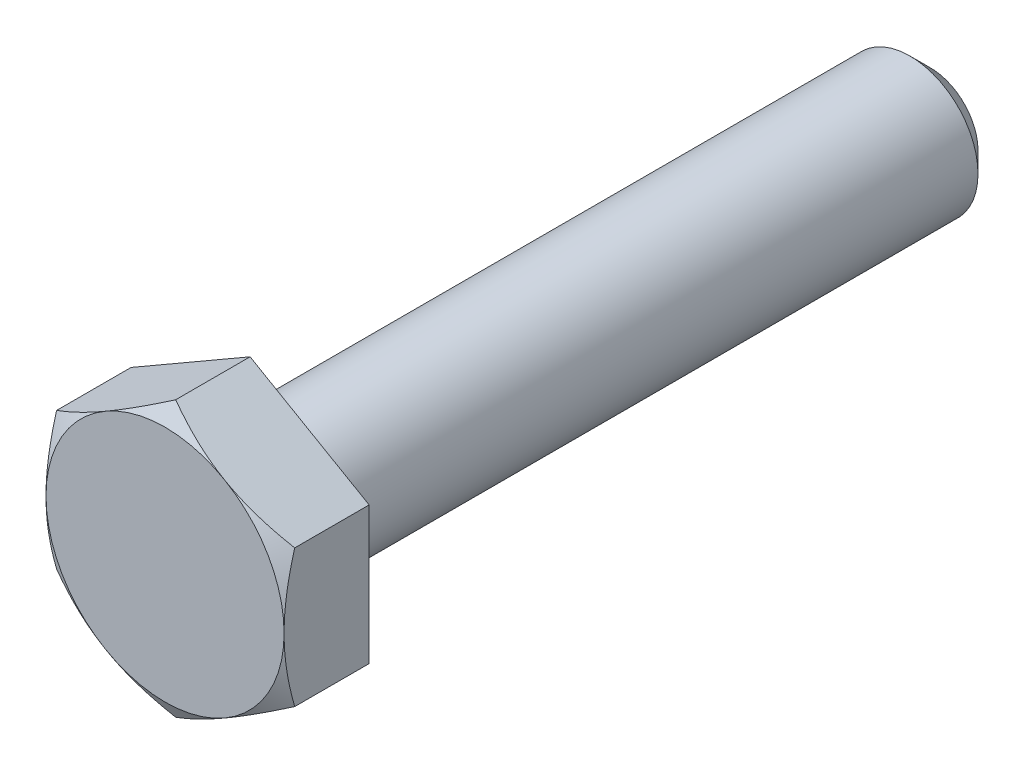
from build123d import *

# Parameters (mm, degrees)
SKETCH4_OUTSIDE_W  = 22.844
SKETCH4_OUTSIDE_H  = 22.844
CUT_EXTRUDE1_DEPTH = 37.85314377


with BuildPart() as part:
    # Sketch3 → Revolve1 (revolve)
    with BuildSketch(Plane(origin=(0, 0, 0), x_dir=(0, 0, -1), z_dir=(1, 0, 0))):
        Polygon((17.859375, 2.2225), (17.859375, 0), (-17.859375, 0), (-17.859375, 5.55625), (-17.363110767, 6.415804866), (-13.890625, 6.415804866), (-13.890625, 3.175), (16.906875, 3.175), align=None)
    revolve(axis=Axis((0, 0, 17.859375), (0, 0, -1)))

    # Sketch4 outside → Cut-Extrude1 (cut, through all)
    with BuildSketch(Plane.XY.offset(17.859375)):
        Rectangle(SKETCH4_OUTSIDE_W, SKETCH4_OUTSIDE_H)
        Polygon((5.55625, -3.207902433), (5.55625, 3.207902433), (0, 6.415804866), (-5.55625, 3.207902433), (-5.55625, -3.207902433), (0, -6.415804866), align=None, mode=Mode.SUBTRACT)
    extrude(amount=-CUT_EXTRUDE1_DEPTH, mode=Mode.SUBTRACT)


solid = part.part
